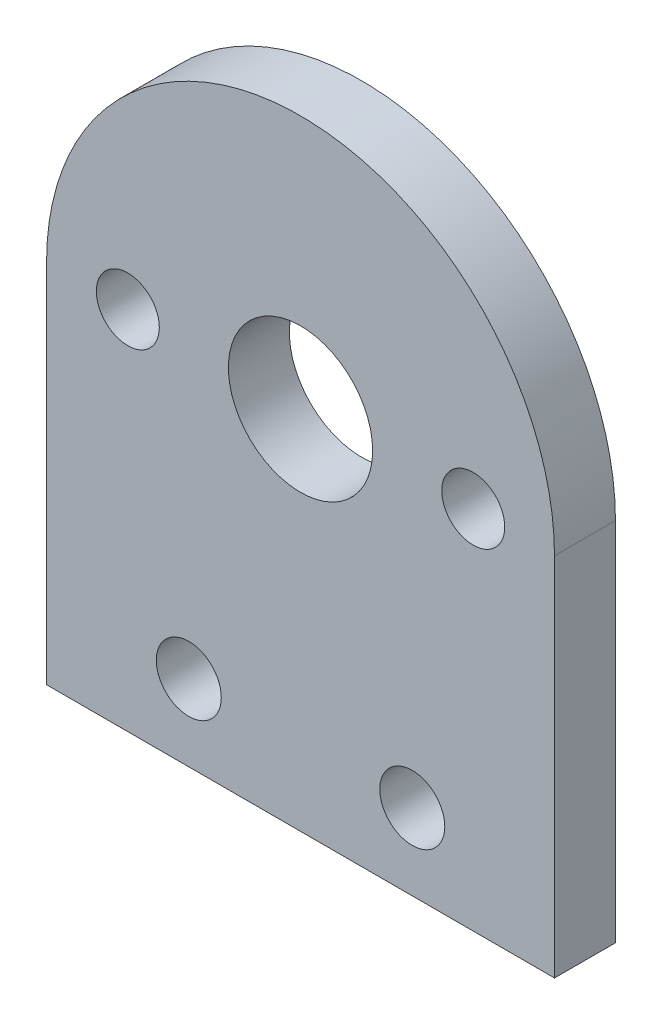
from build123d import *

# Parameters (mm, degrees)
EXTRUDE_1_DEPTH     = 1.5
SKETCH_2_R          = 1.6
CUT_EXTRUDE_1_DEPTH = 3
SKETCH_3_R          = 1.55
SKETCH_3_R_2        = 3.55
CUT_EXTRUDE_2_DEPTH = 3


with BuildPart() as part:
    # 草图1 → 凸台-拉伸1 (new, symmetric)
    with BuildSketch(Plane.XY):
        with BuildLine():
            Line((-25, 0), (0, 0))
            Line((0, 0), (0, 18))
            ThreePointArc((0, 18), (-12.5, 30.5), (-25, 18))
            Line((-25, 18), (-25, 0))
        make_face()
    extrude(amount=EXTRUDE_1_DEPTH, both=True)

    # 草图2 → 切除-拉伸1 (cut)
    with BuildSketch(Plane.XY.offset(1.5)):
        with Locations((-18, 3.75)):
            Circle(SKETCH_2_R)
        with Locations((-7, 3.75)):
            Circle(SKETCH_2_R)
    extrude(amount=-CUT_EXTRUDE_1_DEPTH, mode=Mode.SUBTRACT)

    # 草图3 → 切除-拉伸2 (cut)
    with BuildSketch(Plane.XY.offset(1.5)):
        with Locations((-4, 18)):
            Circle(SKETCH_3_R)
        with Locations((-21, 18)):
            Circle(SKETCH_3_R)
        with Locations((-12.5, 18)):
            Circle(SKETCH_3_R_2)
    extrude(amount=-CUT_EXTRUDE_2_DEPTH, mode=Mode.SUBTRACT)


solid = part.part
